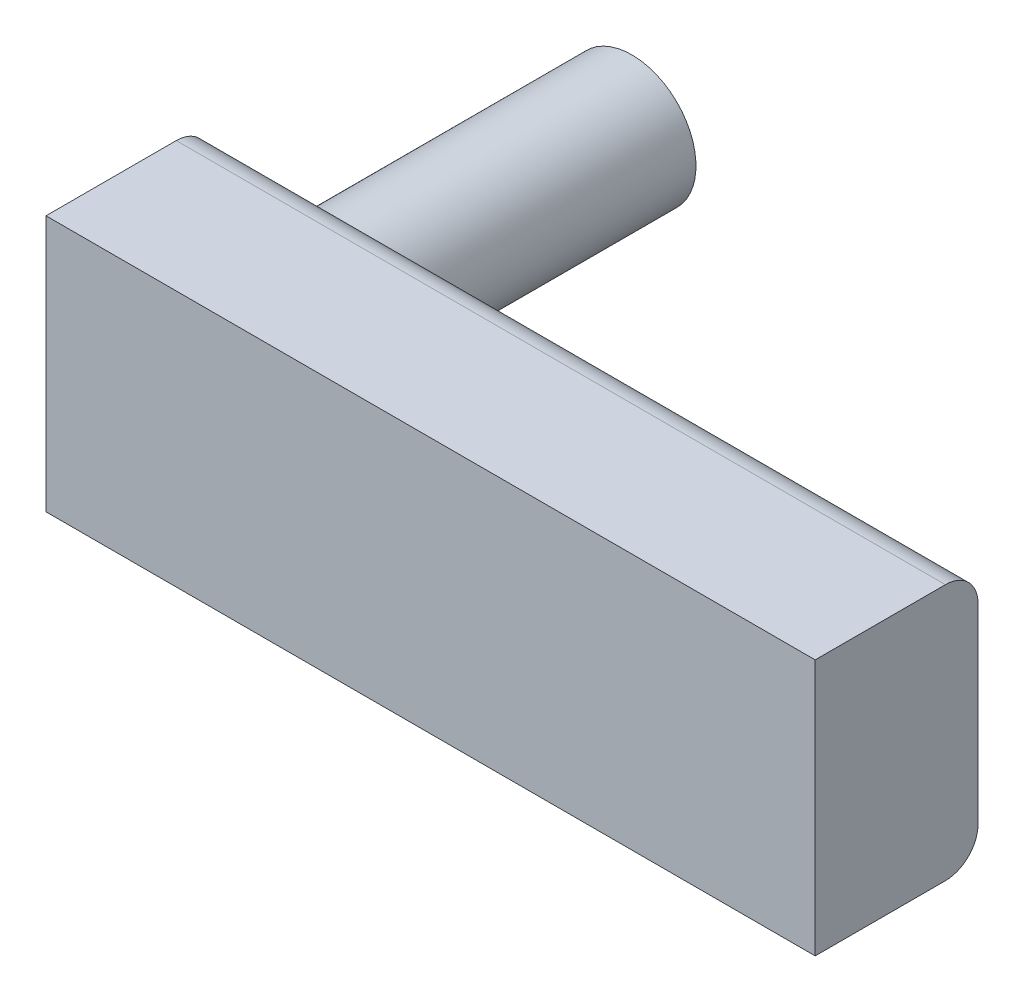
from build123d import *

# Parameters (mm, degrees)
SKETCH1_W           = 60
SKETCH1_H           = 20
BOSS_EXTRUDE2_DEPTH = 12.7
FILLET1_R           = 2.54
FILLET2_R           = 2.54
SKETCH2_R           = 5
BOSS_EXTRUDE3_DEPTH = 25.4


with BuildPart() as part:
    # Sketch1 → Boss-Extrude2 (new body)
    with BuildSketch(Plane.XY):
        with Locations((-52.498731257, -25.490525622)):
            Rectangle(SKETCH1_W, SKETCH1_H)
    extrude(amount=BOSS_EXTRUDE2_DEPTH)

    # Fillet1
    fillet1_edges = [part.edges().sort_by_distance(p)[0] for p in [
        (-52.498731257, -35.490525622, 0),
    ]]
    fillet(fillet1_edges, radius=FILLET1_R)

    # Fillet2
    fillet2_edges = [part.edges().sort_by_distance(p)[0] for p in [
        (-52.498731257, -15.490525622, 0),
    ]]
    fillet(fillet2_edges, radius=FILLET2_R)

    # Sketch2 → Boss-Extrude3 (add)
    with BuildSketch(Plane(origin=(0, 0, 0), x_dir=(-1, 0, 0), z_dir=(0, 0, -1))):
        with Locations((74.89901914, -24.866644028)):
            Circle(SKETCH2_R)
    extrude(amount=BOSS_EXTRUDE3_DEPTH)


solid = part.part
